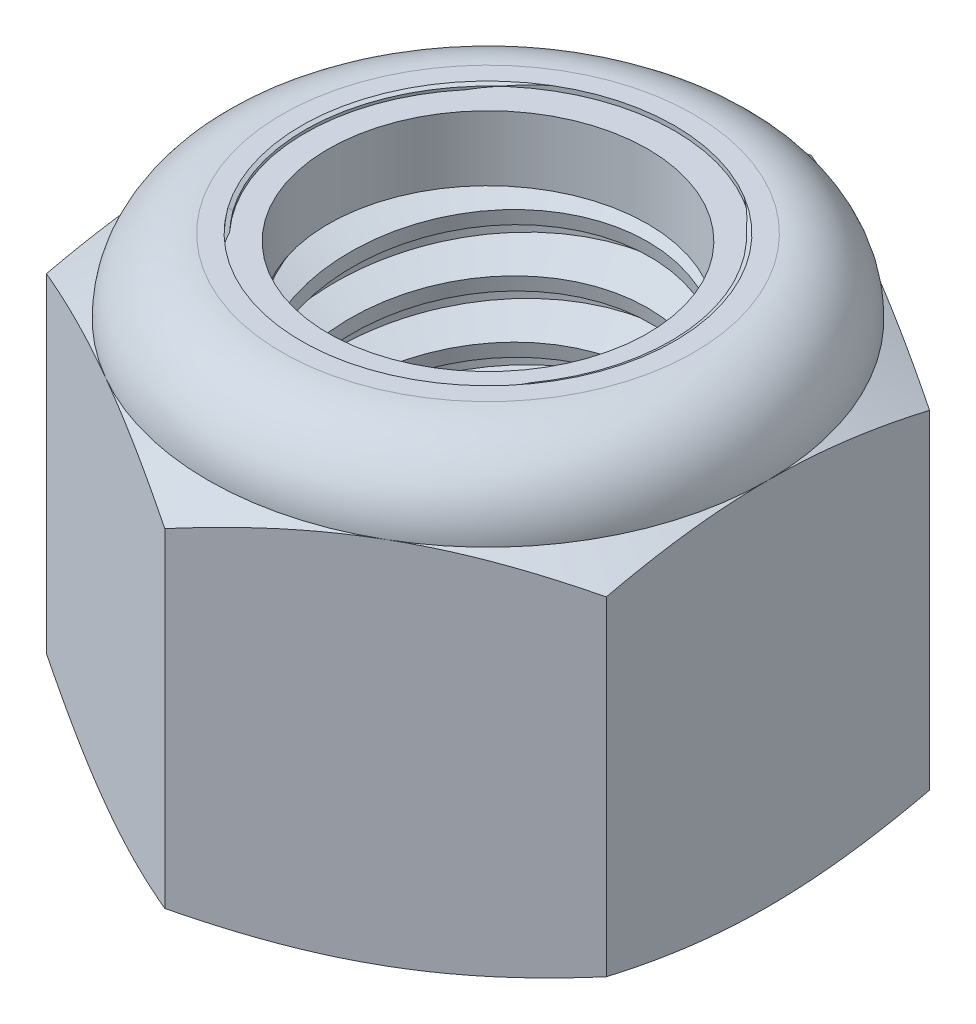
from build123d import *

# Parameters (mm, degrees)
EXTRUDE1_DEPTH      = 15.08125
SKETCH2_W           = 6.35
SKETCH2_H           = 15.08125
LPATTERN1_COUNT     = 8
LPATTERN1_PITCH     = 1.953846154
LPATTERN1_COL_COUNT = 2
LPATTERN1_COL_PITCH = 1.953846154


with BuildPart() as part:
    # Sketch1 → Extrude1 (new body)
    with BuildSketch(Plane(origin=(0, 0, 0), x_dir=(1, 0, 0), z_dir=(0, 1, 0))):
        Polygon((0, 10.998522628), (-9.525, 5.499261314), (-9.525, -5.499261314), (0, -10.998522628), (9.525, -5.499261314), (9.525, 5.499261314), align=None)
    extrude(amount=EXTRUDE1_DEPTH)

    # Sketch4 → Cut-Revolve2 (revolve, cut)
    with BuildSketch(Plane(origin=(0, 0, 0), x_dir=(0, 0, -1), z_dir=(1, 0, 0)), mode=Mode.PRIVATE) as cut_revolve2_sk:
        Polygon((0, 15.08125), (6.35, 15.08125), (5.434726912, 14.65445115), (5.434726912, 0.42679885), (6.35, 0), (0, 0), align=None)
    revolve(cut_revolve2_sk.sketch.rotate(Axis((0, 15.08125, 0), (0, 1, 0)), 55.034193324), axis=Axis((0, 15.08125, 0), (0, 1, 0)), mode=Mode.SUBTRACT)


with BuildPart() as body_2:
    # Sketch2 → Revolve1 (revolve)
    with BuildSketch(Plane(origin=(0, 0, 0), x_dir=(0, 0, -1), z_dir=(1, 0, 0))):
        with Locations((3.175, 7.540625)):
            Rectangle(SKETCH2_W, SKETCH2_H)
    revolve(axis=Axis((0, -6.35, 0), (0, 1, 0)))

    # Sketch3 → Cut-Revolve1 (revolve, cut)
    with BuildSketch(Plane(origin=(0, 0, 0), x_dir=(0, 0, -1), z_dir=(1, 0, 0)), mode=Mode.PRIVATE) as cut_revolve1_sk:
        Polygon((6.387137043, 14.83985922), (6.647096345, 13.15012376), (5.509000998, 13.592792596), (5.434726912, 14.075574156), align=None)
    cut_revolve1 = revolve(cut_revolve1_sk.sketch.rotate(Axis((0, 15.08125, 0.321367977), (0, -0.9883716976506172, -0.15205718425394119)), 180), axis=Axis((0, 15.08125, 0.321367977), (0, -0.9883716976506172, -0.15205718425394119)), mode=Mode.SUBTRACT)

    # LPattern1: Cut-Revolve1 ×8
    with Locations(*[(0, -i * LPATTERN1_PITCH, 0) for i in range(1, LPATTERN1_COUNT)]):
        add(cut_revolve1, mode=Mode.SUBTRACT)

    # LPattern1 col: Cut-Revolve1 ×2
    with Locations(*[(0, i * LPATTERN1_COL_PITCH, 0) for i in range(1, LPATTERN1_COL_COUNT)]):
        add(cut_revolve1, mode=Mode.SUBTRACT)


with BuildPart() as part_1:
    add(part.part)

    # Combine1: cut body 2
    add(body_2.part, mode=Mode.SUBTRACT)

    # Sketch5 → Cut-Revolve3 (revolve, cut)
    with BuildSketch(Plane(origin=(0, 0, 0), x_dir=(0, 0, -1), z_dir=(1, 0, 0)), mode=Mode.PRIVATE) as cut_revolve3_sk:
        with BuildLine():
            Line((0, 0), (9.525, 0))
            Line((9.525, 0), (10.998522628, 0.687114886))
            Line((10.998522628, 0.687114886), (10.998522628, 11.880593447))
            Line((10.998522628, 11.880593447), (9.525, 12.567708333))
            ThreePointArc((9.525, 12.567708333), (8.788800691, 14.345050691), (7.011458333, 15.08125))
            Line((7.011458333, 15.08125), (7.011458333, 16.35125))
            Line((7.011458333, 16.35125), (12.268522628, 16.35125))
            Line((12.268522628, 16.35125), (12.268522628, -1.27))
            Line((12.268522628, -1.27), (0, -1.27))
            Line((0, -1.27), (0, 0))
        make_face()
    revolve(cut_revolve3_sk.sketch.rotate(Axis((0, 0, 0), (0, 1, 0)), 55.034193324), axis=Axis((0, 0, 0), (0, 1, 0)), mode=Mode.SUBTRACT)

    # Sketch6 → Cut-Revolve4 (revolve, cut)
    with BuildSketch(Plane(origin=(0, 0, 0), x_dir=(0, 0, -1), z_dir=(1, 0, 0)), mode=Mode.PRIVATE) as cut_revolve4_sk:
        with BuildLine():
            Line((0, 12.567708333), (9.3726, 12.567708333))
            ThreePointArc((9.3726, 12.567708333), (8.681037617, 14.237287617), (7.011458333, 14.92885))
            Line((7.011458333, 14.92885), (6.223092623, 14.92885))
            Line((6.223092623, 14.92885), (6.223092623, 16.35125))
            Line((6.223092623, 16.35125), (0, 16.35125))
            Line((0, 16.35125), (0, 12.567708333))
        make_face()
    revolve(cut_revolve4_sk.sketch.rotate(Axis((0, 16.35125, 0), (0, 1, 0)), 55.034193324), axis=Axis((0, 16.35125, 0), (0, 1, 0)), mode=Mode.SUBTRACT)


with BuildPart() as body_2_2:
    # Sketch7 → Revolve2 (revolve)
    with BuildSketch(Plane(origin=(0, 0, 0), x_dir=(0, 0, -1), z_dir=(1, 0, 0)), mode=Mode.PRIVATE) as revolve2_sk:
        with BuildLine():
            Line((5.434726912, 12.643908333), (9.295129058, 12.643908333))
            ThreePointArc((9.295129058, 12.643908333), (8.599986877, 14.210125907), (7.011458333, 14.85265))
            Line((7.011458333, 14.85265), (5.434726912, 14.85265))
            Line((5.434726912, 14.85265), (5.434726912, 12.643908333))
        make_face()
    revolve(revolve2_sk.sketch.rotate(Axis((0, 12.643908333, 0), (0, 1, 0)), 55.034193324), axis=Axis((0, 12.643908333, 0), (0, 1, 0)))


solid = Compound([part_1.part, body_2_2.part])
